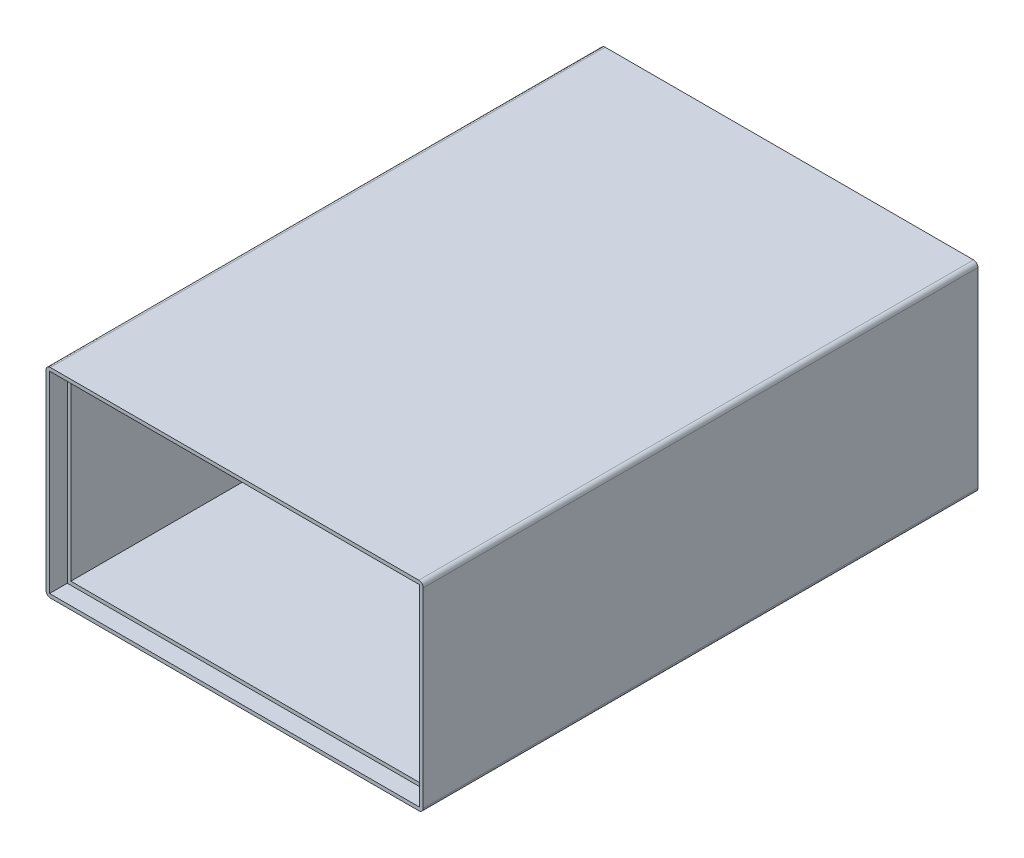
from build123d import *

# Parameters (mm, degrees)
SKETCH_1_W          = 85
SKETCH_1_H          = 45
EXTRUDE_1_DEPTH     = 125
SKETCH_2_W          = 81.8
SKETCH_2_H          = 41.8
CUT_EXTRUDE_1_DEPTH = 123.4
SKETCH_3_W          = 83.4
SKETCH_3_H          = 43.4
CUT_EXTRUDE_2_DEPTH = 4
FILLET_2_R          = 1


with BuildPart() as part:
    # Эскиз1 → Бобышка-Вытянуть1 (new body)
    with BuildSketch(Plane.XY):
        with Locations((42.5, 22.5)):
            Rectangle(SKETCH_1_W, SKETCH_1_H)
    extrude(amount=EXTRUDE_1_DEPTH)

    # Эскиз2 → Вырез-Вытянуть1 (cut)
    with BuildSketch(Plane.XY.offset(125)):
        with Locations((42.5, 22.5)):
            Rectangle(SKETCH_2_W, SKETCH_2_H)
    extrude(amount=-CUT_EXTRUDE_1_DEPTH, mode=Mode.SUBTRACT)

    # Эскиз3 → Вырез-Вытянуть2 (cut)
    with BuildSketch(Plane.XY.offset(125)):
        with Locations((42.5, 22.5)):
            Rectangle(SKETCH_3_W, SKETCH_3_H)
    extrude(amount=-CUT_EXTRUDE_2_DEPTH, mode=Mode.SUBTRACT)

    # Скругление2
    fillet_2_edges = [part.edges().sort_by_distance(p)[0] for p in [
        (0, 45, 62.5),
        (85, 45, 62.5),
        (85, 0, 62.5),
        (0, 0, 62.5),
    ]]
    fillet(fillet_2_edges, radius=FILLET_2_R)


solid = part.part
